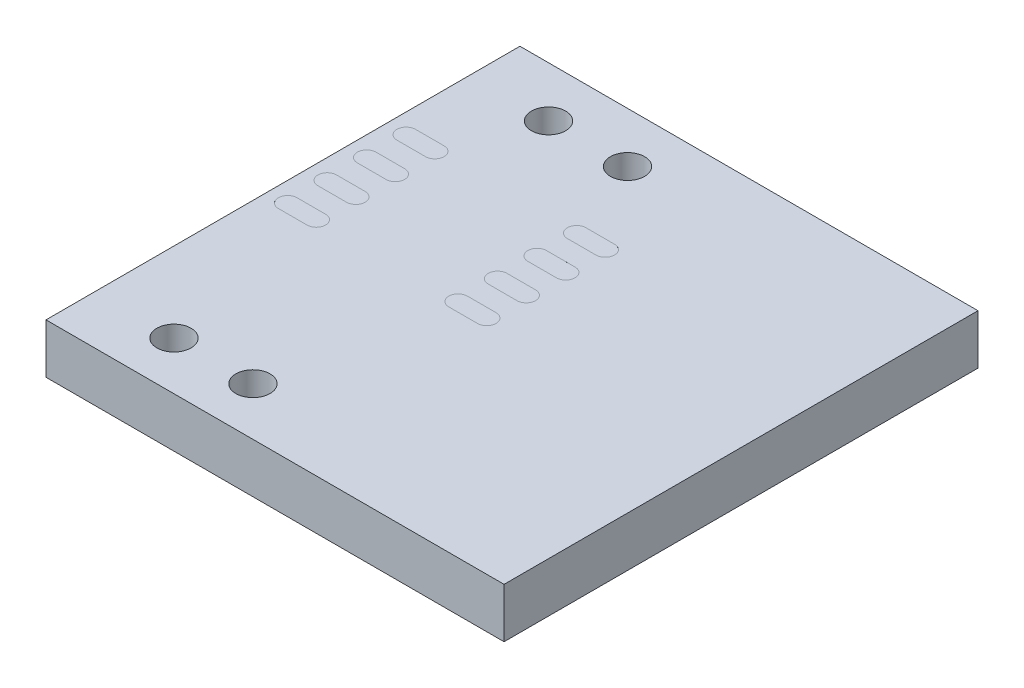
from build123d import *

# Parameters (mm, degrees)
SKETCH_1_W          = 14.73
SKETCH_1_H          = 15.24
EXTRUDE_1_DEPTH     = 1.6
SKETCH_2_R          = 0.55
CUT_EXTRUDE_1_DEPTH = 11.717631501
CUT_EXTRUDE_2_DEPTH = 0.0001


with BuildPart() as part:
    # Эскиз1 → Бобышка-Вытянуть1 (new body)
    with BuildSketch(Plane(origin=(0, 0, 0), x_dir=(1, 0, 0), z_dir=(0, 1, 0))):
        Rectangle(SKETCH_1_W, SKETCH_1_H)
    extrude(amount=EXTRUDE_1_DEPTH)

    # Эскиз2 → Вырез-Вытянуть1 (cut, through all)
    with BuildSketch(Plane(origin=(0, 1.6, 0), x_dir=(1, 0, 0), z_dir=(0, 1, 0))):
        with Locations(Location((-4.825, 6, 0), (0, 0, 270))):
            Circle(SKETCH_2_R)
        with Locations(Location((-2.285, 6, 0), (0, 0, 270))):
            Circle(SKETCH_2_R)
        with Locations(Location((-4.8, -6.07, 0), (0, 0, 270))):
            Circle(SKETCH_2_R)
        with Locations(Location((-2.260000197, -6.071, 0), (0, 0, 270))):
            Circle(SKETCH_2_R)
    extrude(amount=-CUT_EXTRUDE_1_DEPTH, mode=Mode.SUBTRACT)

    # Эскиз3 → Вырез-Вытянуть2 (cut)
    with BuildSketch(Plane(origin=(0, 1.6, 0), x_dir=(1, 0, 0), z_dir=(0, 1, 0))):
        with BuildLine():
            Line((-6.729, 3.627), (-5.809, 3.627))
            ThreePointArc((-5.809, 3.627), (-5.509, 3.327), (-5.809, 3.027))
            Line((-5.809, 3.027), (-6.729, 3.027))
            ThreePointArc((-6.729, 3.027), (-7.029, 3.327), (-6.729, 3.627))
        make_face()
        with BuildLine():
            Line((-6.729, 2.357), (-5.809, 2.357))
            ThreePointArc((-5.809, 2.357), (-5.509, 2.057), (-5.809, 1.757))
            Line((-5.809, 1.757), (-6.729, 1.757))
            ThreePointArc((-6.729, 1.757), (-7.029, 2.057), (-6.729, 2.357))
        make_face()
        with BuildLine():
            Line((-6.729, 1.087), (-5.809, 1.087))
            ThreePointArc((-5.809, 1.087), (-5.509, 0.787), (-5.809, 0.487))
            Line((-5.809, 0.487), (-6.729, 0.487))
            ThreePointArc((-6.729, 0.487), (-7.029, 0.787), (-6.729, 1.087))
        make_face()
        with BuildLine():
            Line((-6.729, -0.183), (-5.809, -0.183))
            ThreePointArc((-5.809, -0.183), (-5.509, -0.483), (-5.809, -0.783))
            Line((-5.809, -0.783), (-6.729, -0.783))
            ThreePointArc((-6.729, -0.783), (-7.029, -0.483), (-6.729, -0.183))
        make_face()
        with BuildLine():
            Line((-1.249, 2.357), (-0.329, 2.357))
            ThreePointArc((-0.329, 2.357), (-0.029, 2.057), (-0.329, 1.757))
            Line((-0.329, 1.757), (-1.249, 1.757))
            ThreePointArc((-1.249, 1.757), (-1.549, 2.057), (-1.249, 2.357))
        make_face()
        with BuildLine():
            Line((-1.249, 1.087), (-0.329, 1.087))
            ThreePointArc((-0.329, 1.087), (-0.029, 0.787), (-0.329, 0.487))
            Line((-0.329, 0.487), (-1.249, 0.487))
            ThreePointArc((-1.249, 0.487), (-1.549, 0.787), (-1.249, 1.087))
        make_face()
        with BuildLine():
            Line((-1.249, -0.183), (-0.329, -0.183))
            ThreePointArc((-0.329, -0.183), (-0.029, -0.483), (-0.329, -0.783))
            Line((-0.329, -0.783), (-1.249, -0.783))
            ThreePointArc((-1.249, -0.783), (-1.549, -0.483), (-1.249, -0.183))
        make_face()
        with BuildLine():
            Line((-1.249, 3.627), (-0.329, 3.627))
            ThreePointArc((-0.329, 3.627), (-0.029, 3.327), (-0.329, 3.027))
            Line((-0.329, 3.027), (-1.249, 3.027))
            ThreePointArc((-1.249, 3.027), (-1.549, 3.327), (-1.249, 3.627))
        make_face()
    extrude(amount=-CUT_EXTRUDE_2_DEPTH, mode=Mode.SUBTRACT)


solid = part.part
